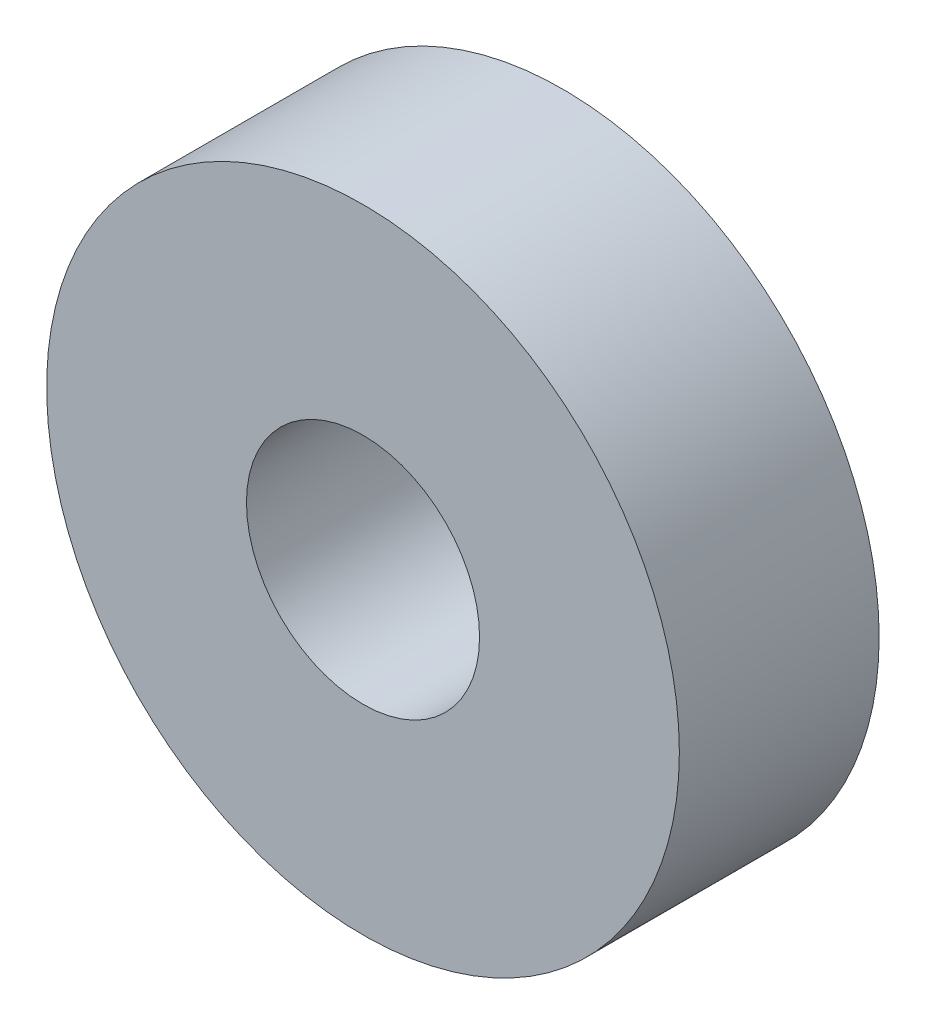
from build123d import *

# Parameters (mm, degrees)
ESQUISSE1_R        = 9.5
ESQUISSE1_R_2      = 3.5
BOSS_EXTRU_1_DEPTH = 6


with BuildPart() as part:
    # Esquisse1 → Boss.-Extru.1 (new body)
    with BuildSketch(Plane.XY):
        Circle(ESQUISSE1_R)
        Circle(ESQUISSE1_R_2, mode=Mode.SUBTRACT)
    extrude(amount=BOSS_EXTRU_1_DEPTH)


solid = part.part
